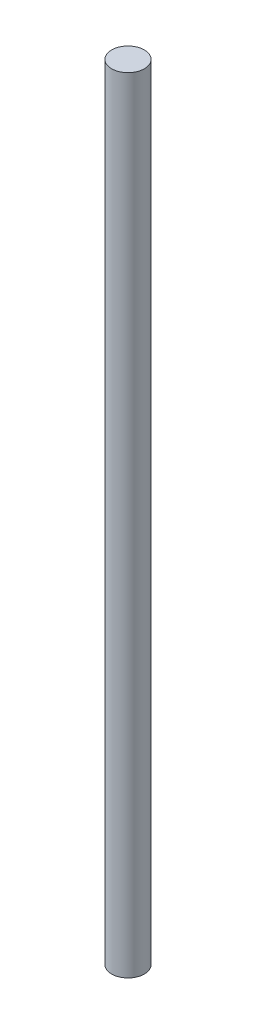
from build123d import *

# Parameters (mm, degrees)
SKETCH1_R           = 25.4
BOSS_EXTRUDE1_DEPTH = 1219.2


with BuildPart() as part:
    # Sketch1 → Boss-Extrude1 (new body)
    with BuildSketch(Plane(origin=(0, 0, 0), x_dir=(1, 0, 0), z_dir=(0, 1, 0))):
        with Locations(Location((0, 0, 0), (0, 0, 90))):
            Circle(SKETCH1_R)
    extrude(amount=BOSS_EXTRUDE1_DEPTH)


solid = part.part
